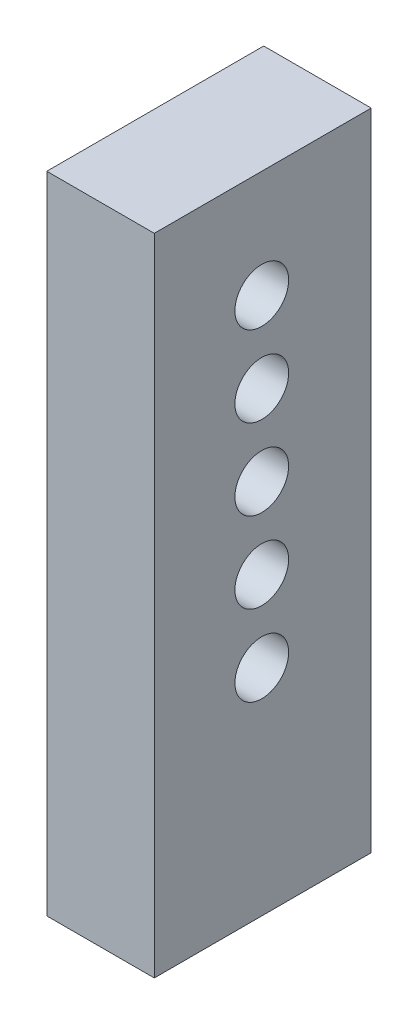
from build123d import *

# Parameters (mm, degrees)
SKETCH1_W           = 51.260430681
SKETCH1_H           = 152.4
SKETCH1_R           = 6.35
BOSS_EXTRUDE1_DEPTH = 25.4
SKETCH6_R           = 2.0193
CUT_EXTRUDE4_DEPTH  = 25.4


with BuildPart() as part:
    # Sketch1 → Boss-Extrude1 (new body)
    with BuildSketch(Plane(origin=(0, 0, 0), x_dir=(0, 0, -1), z_dir=(1, 0, 0))):
        with Locations((-75.96978466, 76.2)):
            Rectangle(SKETCH1_W, SKETCH1_H)
        with Locations((-76.2, 50.8)):
            Circle(SKETCH1_R, mode=Mode.SUBTRACT)
        with Locations((-76.2, 69.85)):
            Circle(SKETCH1_R, mode=Mode.SUBTRACT)
        with Locations((-76.2, 88.9)):
            Circle(SKETCH1_R, mode=Mode.SUBTRACT)
        with Locations((-76.2, 107.95)):
            Circle(SKETCH1_R, mode=Mode.SUBTRACT)
        with Locations((-76.2, 127)):
            Circle(SKETCH1_R, mode=Mode.SUBTRACT)
    extrude(amount=BOSS_EXTRUDE1_DEPTH)

    # Sketch6 → Cut-Extrude4 (cut)
    with BuildSketch(Plane.XZ):
        with Locations(Location((12.7, 75.739569319, 0), (0, 0, 270))):
            Circle(SKETCH6_R)
    extrude(amount=-CUT_EXTRUDE4_DEPTH, mode=Mode.SUBTRACT)


solid = part.part
